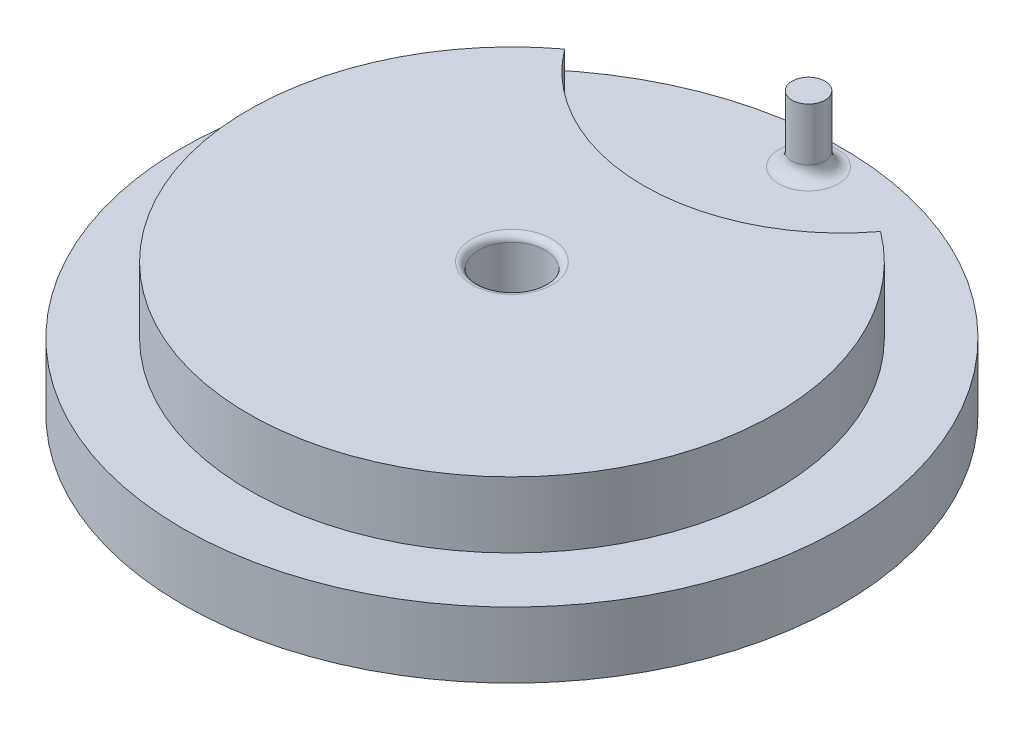
from build123d import *

# Parameters (mm, degrees)
SKETCH1_R           = 63.5
SKETCH1_R_2         = 6.4135
BOSS_EXTRUDE1_DEPTH = 12.7
SKETCH2_R           = 50.7365
SKETCH2_R_2         = 6.4135
BOSS_EXTRUDE2_DEPTH = 12.7
SKETCH3_R           = 38.1
CUT_EXTRUDE2_DEPTH  = 12.7
SKETCH4_R           = 3.175
BOSS_EXTRUDE3_DEPTH = 12.7
FILLET1_R           = 2.54
FILLET2_R           = 5.08
FILLET3_R           = 1.27


with BuildPart() as part:
    # Sketch1 → Boss-Extrude1 (new body)
    with BuildSketch(Plane(origin=(0, 0, 0), x_dir=(1, 0, 0), z_dir=(0, 1, 0))):
        with Locations(Location((0, 0, 0), (0, 0, 270))):
            Circle(SKETCH1_R)
        with Locations(Location((0, 0, 0), (0, 0, 270))):
            Circle(SKETCH1_R_2, mode=Mode.SUBTRACT)
    extrude(amount=BOSS_EXTRUDE1_DEPTH)

    # Sketch2 → Boss-Extrude2 (add)
    with BuildSketch(Plane(origin=(0, 12.7, 0), x_dir=(1, 0, 0), z_dir=(0, 1, 0))):
        with Locations(Location((0, 0, 0), (0, 0, 270))):
            Circle(SKETCH2_R)
        with Locations(Location((0, 0, 0), (0, 0, 270))):
            Circle(SKETCH2_R_2, mode=Mode.SUBTRACT)
    extrude(amount=BOSS_EXTRUDE2_DEPTH)

    # Sketch3 → Cut-Extrude2 (cut)
    with BuildSketch(Plane(origin=(0, 25.4, 0), x_dir=(1, 0, 0), z_dir=(0, 1, 0))):
        with Locations((0, 63.5)):
            Circle(SKETCH3_R)
    extrude(amount=-CUT_EXTRUDE2_DEPTH, mode=Mode.SUBTRACT)

    # Sketch4 → Boss-Extrude3 (add)
    with BuildSketch(Plane(origin=(0, 12.7, 0), x_dir=(1, 0, 0), z_dir=(0, 1, 0))):
        with Locations(Location((0, 57.15, 0), (0, 0, 270))):
            Circle(SKETCH4_R)
    extrude(amount=BOSS_EXTRUDE3_DEPTH)

    # Fillet1
    fillet1_edges = [part.edges().sort_by_distance(p)[0] for p in [
        (0, 12.7, -60.325),
    ]]
    fillet(fillet1_edges, radius=FILLET1_R)

    # Fillet2
    fillet2_edges = [part.edges().sort_by_distance(p)[0] for p in [
        (0, 0, -6.4135),
    ]]
    fillet(fillet2_edges, radius=FILLET2_R)

    # Fillet3
    fillet3_edges = [part.edges().sort_by_distance(p)[0] for p in [
        (0, 25.4, -6.4135),
    ]]
    fillet(fillet3_edges, radius=FILLET3_R)


solid = part.part
